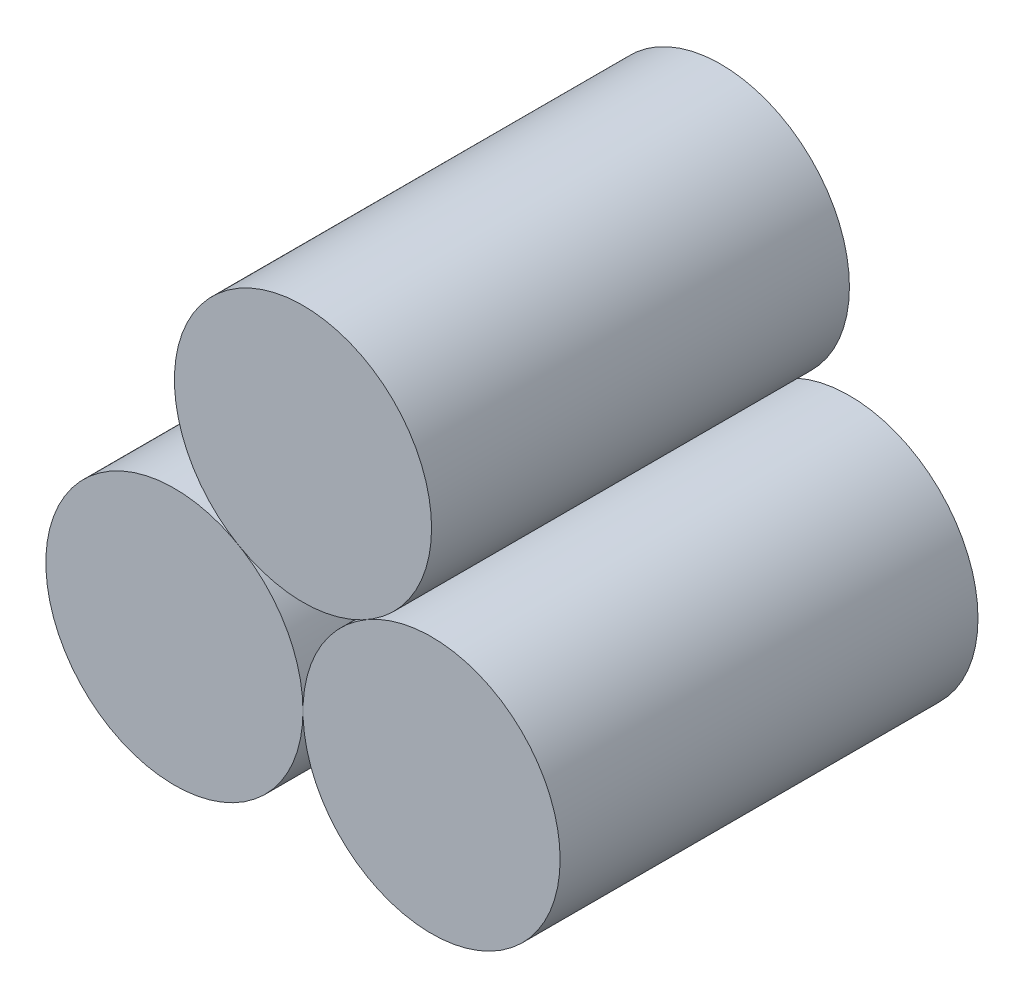
from build123d import *

# Parameters (mm, degrees)
EXTRUDE_1_DEPTH        = 2.5
EXTRUDE_1_DEPTH_BACK   = 4
SKETCH_1_R             = 2
EXTRUDE_1_2_DEPTH      = 2.5
EXTRUDE_1_2_DEPTH_BACK = 4
EXTRUDE_1_3_DEPTH      = 2.5
EXTRUDE_1_3_DEPTH_BACK = 4


with BuildPart() as part:
    # Эскиз1 → Бобышка-Вытянуть1 (new, two sides: drawn at the far end of the back side and taken through both)
    with BuildSketch(Plane.XY.offset(-EXTRUDE_1_DEPTH_BACK)):
        with Locations((-2, 3.834936491)):
            Circle(SKETCH_1_R)
    extrude(amount=EXTRUDE_1_DEPTH + EXTRUDE_1_DEPTH_BACK)


with BuildPart() as body_2:
    # Эскиз1 → Extrude 1 2 (new, two sides: drawn at the far end of the back side and taken through both)
    with BuildSketch(Plane.XY.offset(-EXTRUDE_1_2_DEPTH_BACK)):
        with Locations((0, 7.299038106)):
            Circle(SKETCH_1_R)
    extrude(amount=EXTRUDE_1_2_DEPTH + EXTRUDE_1_2_DEPTH_BACK)


with BuildPart() as body_3:
    # Эскиз1 → Extrude 1 3 (new, two sides: drawn at the far end of the back side and taken through both)
    with BuildSketch(Plane.XY.offset(-EXTRUDE_1_3_DEPTH_BACK)):
        with Locations((2, 3.834936491)):
            Circle(SKETCH_1_R)
    extrude(amount=EXTRUDE_1_3_DEPTH + EXTRUDE_1_3_DEPTH_BACK)


solid = Compound([part.part, body_2.part, body_3.part])
